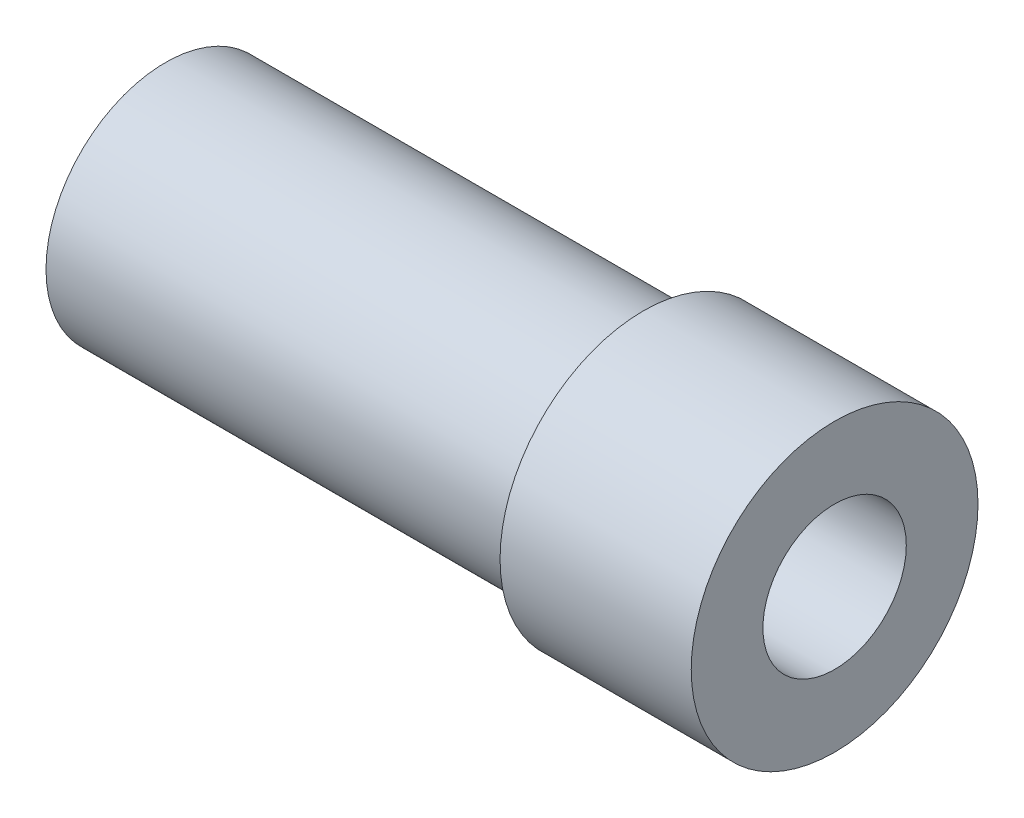
from build123d import *

# Parameters (mm, degrees)
SKETCH2_R           = 7.9375
SKETCH2_R_2         = 4.7625
BOSS_EXTRUDE1_DEPTH = 44.45
BOSS_EXTRUDE2_START = -12.7
SKETCH3_R           = 9.525
SKETCH3_R_2         = 7.9375
BOSS_EXTRUDE2_DEPTH = 12.7


with BuildPart() as part:
    # Sketch2 → Boss-Extrude1 (new body)
    with BuildSketch(Plane.YZ):
        with Locations(Location((0, 0, 0), (0, 0, 270))):
            Circle(SKETCH2_R)
        with Locations(Location((0, 0, 0), (0, 0, 270))):
            Circle(SKETCH2_R_2, mode=Mode.SUBTRACT)
    extrude(amount=BOSS_EXTRUDE1_DEPTH)

    # Sketch3 → Boss-Extrude2 (add)
    with BuildSketch(Plane.YZ.offset(44.45).offset(BOSS_EXTRUDE2_START)):
        with Locations(Location((0, 0, 0), (0, 0, 270))):
            Circle(SKETCH3_R)
        with Locations(Location((0, 0, 0), (0, 0, 270))):
            Circle(SKETCH3_R_2, mode=Mode.SUBTRACT)
    extrude(amount=BOSS_EXTRUDE2_DEPTH)


solid = part.part
